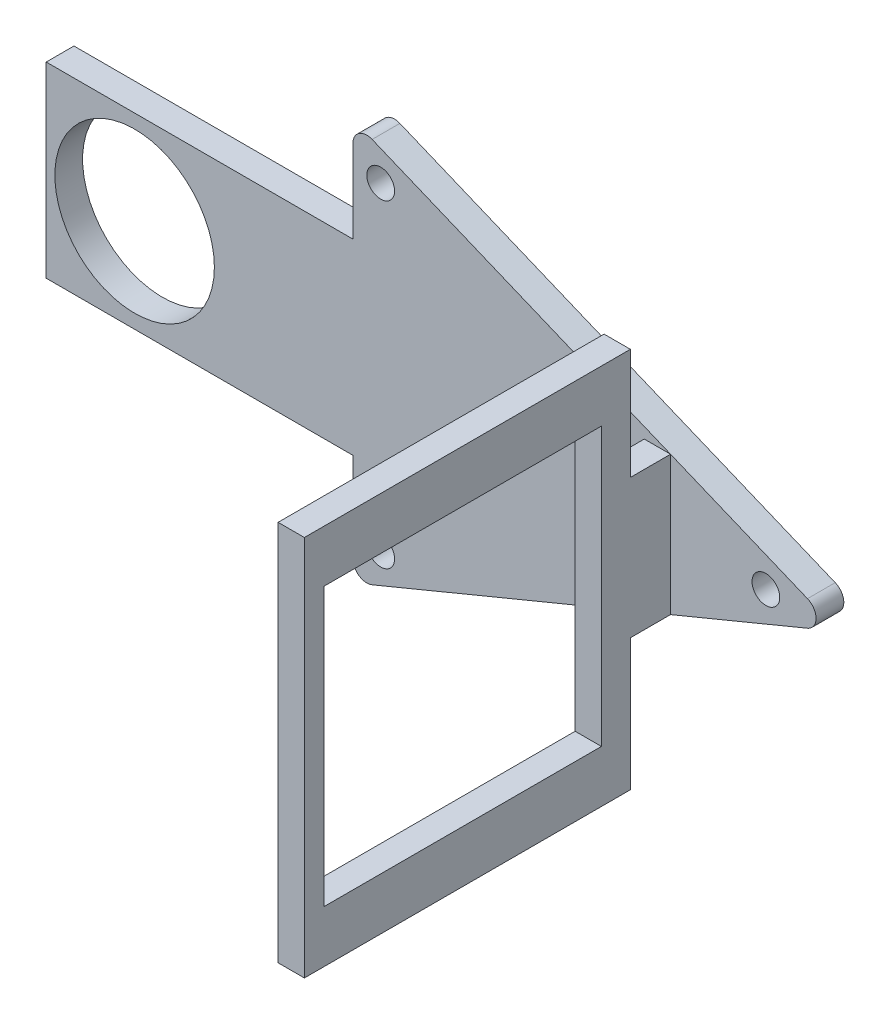
from build123d import *

# Parameters (mm, degrees)
Y_KSEKLIK_EKSTR_ZYON1_DEPTH = 4
IZIM2_W                     = 4
IZIM2_H                     = 27
Y_KSEKLIK_EKSTR_ZYON2_DEPTH = 44.221383782
Y_KSEKLIK_EKSTR_ZYON3_REACH = 97.396
IZIM3_W                     = 3.790620303
IZIM3_H                     = 20.022795238
IZIM4_W                     = 3.790620303
IZIM4_H                     = 47
Y_KSEKLIK_EKSTR_ZYON4_DEPTH = 16
IZIM5_W                     = 3.790620303
IZIM5_H                     = 47
Y_KSEKLIK_EKSTR_ZYON5_DEPTH = 18.977204763
IZIM6_W                     = 40
IZIM6_H                     = 40
KES_EKSTR_ZYON1_DEPTH       = 111.308229444
F_23_0_23_AP_DELIK1_D       = 23
F_4_0_4_AP_DELIK1_D         = 4
F_4_0_4_AP_DELIK1_DEPTH     = 56.792653887


with BuildPart() as part:
    # Çizim1 → Yükseklik-Ekstrüzyon1 (new body)
    with BuildSketch(Plane.XY.offset(4)):
        with BuildLine():
            Line((-27.146814404, 25.956036228), (-27.146814404, -25.956036228))
            ThreePointArc((-27.146814404, -25.956036228), (-26.258437345, -27.618652972), (-24.382519966, -27.804239142))
            Line((-24.382519966, -27.804239142), (38.383894912, -1.848202914))
            ThreePointArc((38.383894912, -1.848202914), (39.619600474, 0), (38.383894912, 1.848202914))
            Line((38.383894912, 1.848202914), (-24.382519966, 27.804239142))
            ThreePointArc((-24.382519966, 27.804239142), (-26.258437345, 27.618652972), (-27.146814404, 25.956036228))
        make_face()
    extrude(amount=-Y_KSEKLIK_EKSTR_ZYON1_DEPTH)

    # Çizim2 → Yükseklik-Ekstrüzyon2 (add)
    with BuildSketch(Plane.ZY.offset(27.146814404)):
        with Locations((2, 0.476036228)):
            Rectangle(IZIM2_W, IZIM2_H)
    extrude(amount=Y_KSEKLIK_EKSTR_ZYON2_DEPTH)

    # Çizim3 → Yükseklik-Ekstrüzyon3 (add, up to next)
    with BuildSketch(Plane.XY.offset(56.792653887), mode=Mode.PRIVATE) as y_kseklik_ekstr_zyon3_sk1:
        with Locations((16.748495748, 0)):
            Rectangle(IZIM3_W, IZIM3_H)
    y_kseklik_ekstr_zyon3_tool1 = extrude(y_kseklik_ekstr_zyon3_sk1.sketch, amount=-Y_KSEKLIK_EKSTR_ZYON3_REACH, mode=Mode.PRIVATE) - part.part
    add(y_kseklik_ekstr_zyon3_tool1.solids().sort_by_distance((16.748496, 0, 56.792654))[0])

    # Çizim4 → Yükseklik-Ekstrüzyon4 (add)
    with BuildSketch(Plane(origin=(0, 10.011397619, 0), x_dir=(-1, 0, 0), z_dir=(0, 1, 0))):
        with Locations((-16.748495748, 33.292653887)):
            Rectangle(IZIM4_W, IZIM4_H)
    extrude(amount=Y_KSEKLIK_EKSTR_ZYON4_DEPTH)

    # Çizim5 → Yükseklik-Ekstrüzyon5 (add)
    with BuildSketch(Plane.XZ.offset(10.011397619)):
        with Locations((16.748495748, 33.292653887)):
            Rectangle(IZIM5_W, IZIM5_H)
    extrude(amount=Y_KSEKLIK_EKSTR_ZYON5_DEPTH)

    # Çizim6 → Kes-Ekstrüzyon1 (cut, through all)
    with BuildSketch(Plane(origin=(18.643805899, 0, 0), x_dir=(0, 0, -1), z_dir=(1, 0, 0))):
        with Locations((-33.968638069, -1.488602381)):
            Rectangle(IZIM6_W, IZIM6_H)
    extrude(amount=-KES_EKSTR_ZYON1_DEPTH, mode=Mode.SUBTRACT)

    # Ø23.0 (23) Çap Delik1 (through all)
    with Locations(Plane.XY.offset(4)):
        with Locations((-58.625359309, 0.476036228)):
            Hole(F_23_0_23_AP_DELIK1_D / 2)

    # Ø4.0 (4) Çap Delik1
    with Locations(Plane(origin=(0, 0, 0), x_dir=(-1, 0, 0), z_dir=(0, 0, -1))):
        with Locations((23.146814404, -22.964704035), (23.146814404, 22.964704035), (-32.386015353, 0)):
            Hole(F_4_0_4_AP_DELIK1_D / 2, depth=F_4_0_4_AP_DELIK1_DEPTH)


solid = part.part
